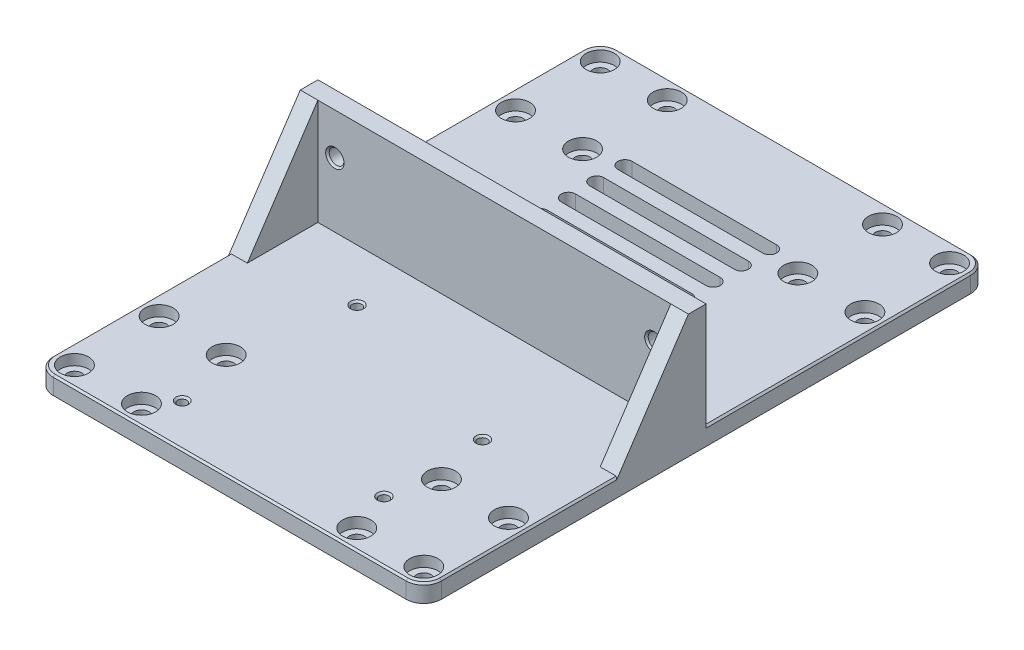
from build123d import *

# Parameters (mm, degrees)
SKICA2_W                 = 110
SKICA2_H                 = 160
P_IDAT_VYSUNUT_M1_DEPTH  = 5
SKICA3_W                 = 110
SKICA3_H                 = 5
P_IDAT_VYSUNUT_M2_DEPTH  = 30
P_IDAT_VYSUNUT_M3_DEPTH  = 5
P_IDAT_VYSUNUT_M4_DEPTH  = 5
SKICA6_R                 = 2.1
ODEBRAT_VYSUNUT_M1_DEPTH = 5
SKICA8_R                 = 1.3
SKICA8_R_2               = 1.35
ODEBRAT_VYSUNUT_M3_DEPTH = 5
SKICA9_R                 = 2.1
ODEBRAT_VYSUNUT_M4_DEPTH = 5
SKICA10_R                = 4
ODEBRAT_VYSUNUT_M5_DEPTH = 3
ZAOBLIT1_R               = 5
ZKOSEN_3_SIZE            = 0.5
ZKOSEN_6_SIZE            = 0.5
ODEBRAT_VYSUNUT_M6_DEPTH = 5
ZKOSEN_7_SIZE            = 0.5


with BuildPart() as part:
    # Skica2 → Přidat vysunutím1 (new body)
    with BuildSketch(Plane(origin=(0, 0, 0), x_dir=(1, 0, 0), z_dir=(0, 1, 0))):
        with Locations((55, 80)):
            Rectangle(SKICA2_W, SKICA2_H)
    extrude(amount=P_IDAT_VYSUNUT_M1_DEPTH)

    # Skica3 → Přidat vysunutím2 (add)
    with BuildSketch(Plane(origin=(0, 5, 0), x_dir=(1, 0, 0), z_dir=(0, 1, 0))):
        with Locations((55, 77.5)):
            Rectangle(SKICA3_W, SKICA3_H)
    extrude(amount=P_IDAT_VYSUNUT_M2_DEPTH)

    # Skica4 → Přidat vysunutím3 (add)
    with BuildSketch(Plane.ZY):
        Polygon((-75, 35), (-55, 5), (-75, 5), align=None)
    extrude(amount=-P_IDAT_VYSUNUT_M3_DEPTH)

    # Skica5 → Přidat vysunutím4 (add)
    with BuildSketch(Plane(origin=(110, 0, 0), x_dir=(0, 0, -1), z_dir=(1, 0, 0))):
        Polygon((75, 35), (55, 5), (75, 5), align=None)
    extrude(amount=-P_IDAT_VYSUNUT_M4_DEPTH)

    # Skica6 → Odebrat vysunutím1 (cut)
    with BuildSketch(Plane(origin=(0, 0, -80), x_dir=(-1, 0, 0), z_dir=(0, 0, -1))):
        with Locations((-100.2, 23.25)):
            Circle(SKICA6_R)
        with Locations((-9.8, 23.25)):
            Circle(SKICA6_R)
    extrude(amount=-ODEBRAT_VYSUNUT_M1_DEPTH, mode=Mode.SUBTRACT)

    # Skica8 → Odebrat vysunutím3 (cut)
    with BuildSketch(Plane(origin=(0, 5, 0), x_dir=(1, 0, 0), z_dir=(0, 1, 0))):
        with Locations(Location((29.55, 12, 0), (0, 0, 270))):
            Circle(SKICA8_R)
        with Locations(Location((30.82, 60.26, 0), (0, 0, 270))):
            Circle(SKICA8_R_2)
        with Locations(Location((81.62, 17.09, 0), (0, 0, 270))):
            Circle(SKICA8_R_2)
        with Locations(Location((81.62, 45.03, 0), (0, 0, 270))):
            Circle(SKICA8_R_2)
    extrude(amount=-ODEBRAT_VYSUNUT_M3_DEPTH, mode=Mode.SUBTRACT)

    # Skica9 → Odebrat vysunutím4 (cut)
    with BuildSketch(Plane.XZ):
        with Locations(Location((5.5, -5.5, 0), (0, 0, 270))):
            Circle(SKICA9_R)
        with Locations(Location((24.5, -5.5, 0), (0, 0, 270))):
            Circle(SKICA9_R)
        with Locations(Location((5.5, -29.5, 0), (0, 0, 270))):
            Circle(SKICA9_R)
        with Locations(Location((24.5, -29.5, 0), (0, 0, 270))):
            Circle(SKICA9_R)
        with Locations(Location((85.5, -29.5, 0), (0, 0, 270))):
            Circle(SKICA9_R)
        with Locations(Location((104.5, -29.5, 0), (0, 0, 270))):
            Circle(SKICA9_R)
        with Locations(Location((85.5, -5.5, 0), (0, 0, 270))):
            Circle(SKICA9_R)
        with Locations(Location((104.5, -5.5, 0), (0, 0, 270))):
            Circle(SKICA9_R)
        with Locations(Location((104.5, -154.5, 0), (0, 0, 270))):
            Circle(SKICA9_R)
        with Locations(Location((85.5, -154.5, 0), (0, 0, 270))):
            Circle(SKICA9_R)
        with Locations(Location((104.5, -130.5, 0), (0, 0, 270))):
            Circle(SKICA9_R)
        with Locations(Location((85.5, -130.5, 0), (0, 0, 270))):
            Circle(SKICA9_R)
        with Locations(Location((24.5, -130.5, 0), (0, 0, 270))):
            Circle(SKICA9_R)
        with Locations(Location((5.5, -130.5, 0), (0, 0, 270))):
            Circle(SKICA9_R)
        with Locations(Location((24.5, -154.5, 0), (0, 0, 270))):
            Circle(SKICA9_R)
        with Locations(Location((5.5, -154.5, 0), (0, 0, 270))):
            Circle(SKICA9_R)
    extrude(amount=-ODEBRAT_VYSUNUT_M4_DEPTH, mode=Mode.SUBTRACT)

    # Skica10 → Odebrat vysunutím5 (cut)
    with BuildSketch(Plane(origin=(0, 5, 0), x_dir=(1, 0, 0), z_dir=(0, 1, 0))):
        with Locations(Location((5.5, 154.5, 0), (0, 0, 270))):
            Circle(SKICA10_R)
        with Locations(Location((24.5, 154.5, 0), (0, 0, 270))):
            Circle(SKICA10_R)
        with Locations(Location((5.5, 130.5, 0), (0, 0, 270))):
            Circle(SKICA10_R)
        with Locations(Location((24.5, 130.5, 0), (0, 0, 270))):
            Circle(SKICA10_R)
        with Locations(Location((85.5, 130.5, 0), (0, 0, 90))):
            Circle(SKICA10_R)
        with Locations(Location((104.5, 130.5, 0), (0, 0, 90))):
            Circle(SKICA10_R)
        with Locations(Location((85.5, 154.5, 0), (0, 0, 90))):
            Circle(SKICA10_R)
        with Locations(Location((104.5, 154.5, 0), (0, 0, 90))):
            Circle(SKICA10_R)
        with Locations(Location((104.5, 5.5, 0), (0, 0, 270))):
            Circle(SKICA10_R)
        with Locations(Location((85.5, 5.5, 0), (0, 0, 270))):
            Circle(SKICA10_R)
        with Locations(Location((104.5, 29.5, 0), (0, 0, 270))):
            Circle(SKICA10_R)
        with Locations(Location((85.5, 29.5, 0), (0, 0, 270))):
            Circle(SKICA10_R)
        with Locations(Location((24.5, 29.5, 0), (0, 0, 90))):
            Circle(SKICA10_R)
        with Locations(Location((5.5, 29.5, 0), (0, 0, 90))):
            Circle(SKICA10_R)
        with Locations(Location((24.5, 5.5, 0), (0, 0, 90))):
            Circle(SKICA10_R)
        with Locations(Location((5.5, 5.5, 0), (0, 0, 90))):
            Circle(SKICA10_R)
    extrude(amount=-ODEBRAT_VYSUNUT_M5_DEPTH, mode=Mode.SUBTRACT)

    # Zaoblit1
    zaoblit1_edges = [part.edges().sort_by_distance(p)[0] for p in [
        (0, 2.5, -160),
        (110, 2.5, -160),
        (110, 2.5, 0),
        (0, 2.5, 0),
    ]]
    fillet(zaoblit1_edges, radius=ZAOBLIT1_R)

    # Zkosení3
    zkosen_3_edges = [part.edges().sort_by_distance(p)[0] for p in [
        (110, 5, -117.5),
        (110, 5, -30),
        (55, 5, 0),
        (1.464466094, 5, -1.464466094),
        (108.535533906, 5, -1.464466094),
        (55, 5, -160),
        (0, 5, -117.5),
        (1.464466094, 5, -158.535533906),
        (108.535533906, 5, -158.535533906),
        (0, 5, -30),
    ]]
    chamfer(zkosen_3_edges, length=ZKOSEN_3_SIZE)

    # Zkosení6
    zkosen_6_edges = [part.edges().sort_by_distance(p)[0] for p in [
        (102.3, 23.25, -80),
        (102.3, 23.25, -75),
        (11.9, 23.25, -80),
        (11.9, 23.25, -75),
    ]]
    chamfer(zkosen_6_edges, length=ZKOSEN_6_SIZE)

    # Skica11 → Odebrat vysunutím6 (cut)
    with BuildSketch(Plane(origin=(0, 5, 0), x_dir=(1, 0, 0), z_dir=(0, 1, 0))):
        with BuildLine():
            Line((34.5, 134.5), (75.5, 134.5))
            ThreePointArc((75.5, 134.5), (77.5, 132.5), (75.5, 130.5))
            Line((75.5, 130.5), (34.5, 130.5))
            ThreePointArc((34.5, 130.5), (32.5, 132.5), (34.5, 134.5))
        make_face()
        with BuildLine():
            Line((34.5, 126.5), (75.5, 126.5))
            ThreePointArc((75.5, 126.5), (77.5, 124.5), (75.5, 122.5))
            Line((75.5, 122.5), (34.5, 122.5))
            ThreePointArc((34.5, 122.5), (32.5, 124.5), (34.5, 126.5))
        make_face()
        with BuildLine():
            Line((34.5, 118.5), (75.5, 118.5))
            ThreePointArc((75.5, 118.5), (77.5, 116.5), (75.5, 114.5))
            Line((75.5, 114.5), (34.5, 114.5))
            ThreePointArc((34.5, 114.5), (32.5, 116.5), (34.5, 118.5))
        make_face()
        with BuildLine():
            Line((34.5, 110.5), (75.5, 110.5))
            ThreePointArc((75.5, 110.5), (77.5, 108.5), (75.5, 106.5))
            Line((75.5, 106.5), (34.5, 106.5))
            ThreePointArc((34.5, 106.5), (32.5, 108.5), (34.5, 110.5))
        make_face()
        with BuildLine():
            Line((34.5, 102.5), (75.5, 102.5))
            ThreePointArc((75.5, 102.5), (77.5, 100.5), (75.5, 98.5))
            Line((75.5, 98.5), (34.5, 98.5))
            ThreePointArc((34.5, 98.5), (32.5, 100.5), (34.5, 102.5))
        make_face()
        with BuildLine():
            Line((34.5, 94.5), (75.5, 94.5))
            ThreePointArc((75.5, 94.5), (77.5, 92.5), (75.5, 90.5))
            Line((75.5, 90.5), (34.5, 90.5))
            ThreePointArc((34.5, 90.5), (32.5, 92.5), (34.5, 94.5))
        make_face()
        with BuildLine():
            Line((34.5, 86.5), (75.5, 86.5))
            ThreePointArc((75.5, 86.5), (77.5, 84.5), (75.5, 82.5))
            Line((75.5, 82.5), (34.5, 82.5))
            ThreePointArc((34.5, 82.5), (32.5, 84.5), (34.5, 86.5))
        make_face()
    extrude(amount=-ODEBRAT_VYSUNUT_M6_DEPTH, mode=Mode.SUBTRACT)

    # Zkosení7
    zkosen_7_edges = [part.edges().sort_by_distance(p)[0] for p in [
        (30.82, 5, -61.61),
        (29.55, 5, -13.3),
        (81.62, 5, -18.44),
        (81.62, 5, -46.38),
    ]]
    chamfer(zkosen_7_edges, length=ZKOSEN_7_SIZE)


solid = part.part
